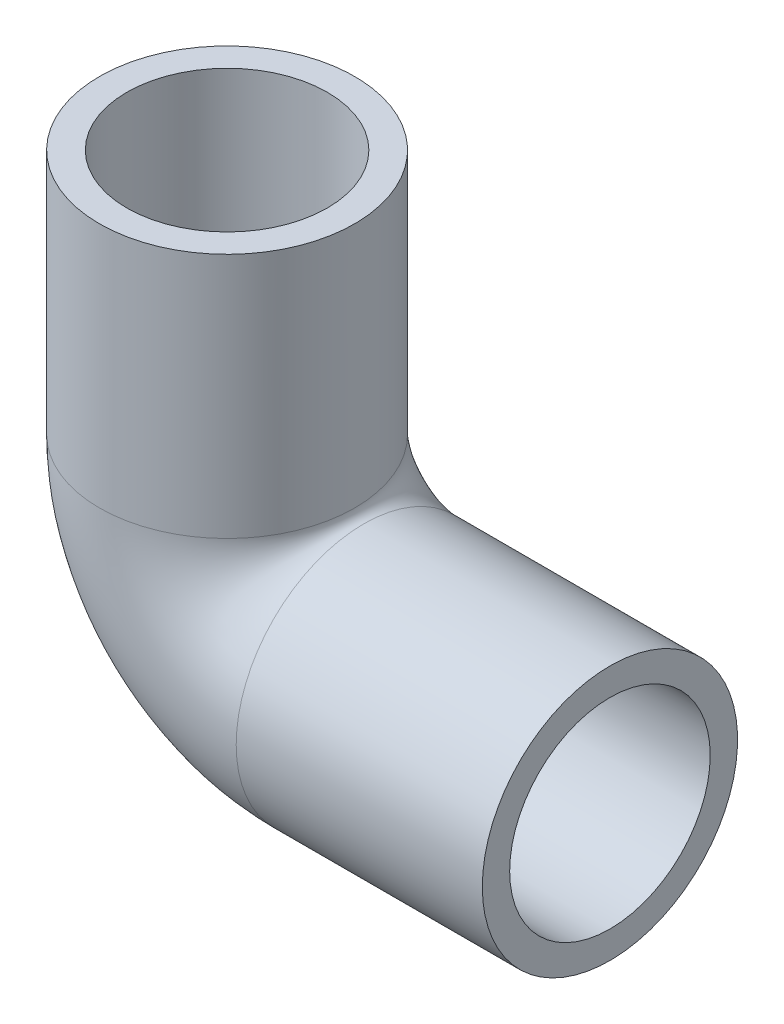
from build123d import *

# Parameters (mm, degrees)
SKETCH2_R   = 14
SKETCH2_R_2 = 11


with BuildPart() as part:
    # Sweep2: sweep along a path in Sketch1
    with BuildLine(Plane.XY) as sweep2_path:
        Line((0, 42), (0, 15))
        ThreePointArc((0, 15), (4.393398282, 4.393398282), (15, 0))
        Line((15, 0), (42, 0))
    # Sketch2 → Sweep2 (sweep)
    with BuildSketch(Plane(origin=(0, 42, 0), x_dir=(1, 0, 0), z_dir=(0, 1, 0))):
        Circle(SKETCH2_R)
        Circle(SKETCH2_R_2, mode=Mode.SUBTRACT)
    sweep(path=sweep2_path.line)


solid = part.part
